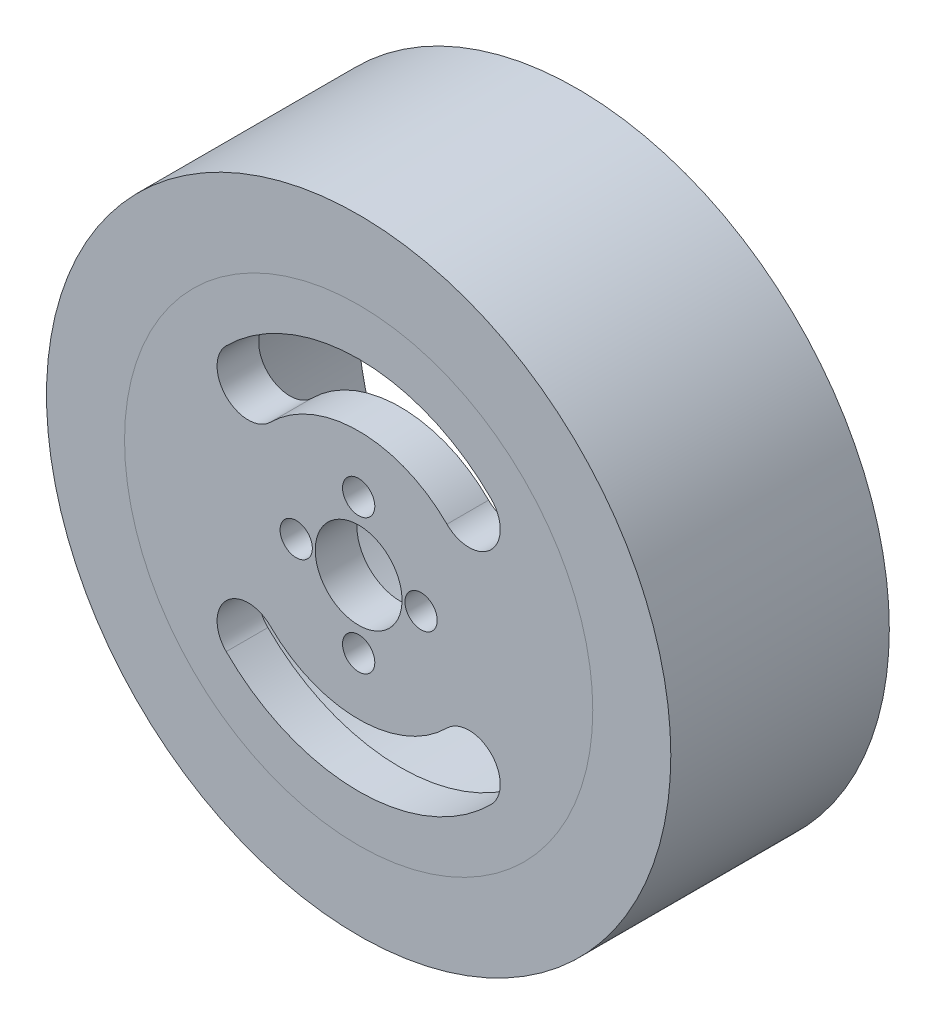
from build123d import *

# Parameters (mm, degrees)
SKETCH_1_R          = 22.5
EXTRUDE_1_DEPTH     = 21
SKETCH_2_R          = 21
CUT_EXTRUDE_1_DEPTH = 17
SKETCH_3_R          = 3
SKETCH_3_R_2        = 4.17
SKETCH_3_R_3        = 1.55
CUT_EXTRUDE_2_DEPTH = 37.076308015
SKETCH_5_R          = 30
SKETCH_5_R_2        = 22.5
EXTRUDE_2_DEPTH     = 21


with BuildPart() as part:
    # ｽｹｯﾁ1 → ﾎﾞｽ - 押し出し1 (new body)
    with BuildSketch(Plane.XY):
        with Locations(Location((0, 0, 0), (0, 0, 180))):
            Circle(SKETCH_1_R)
    extrude(amount=EXTRUDE_1_DEPTH)

    # ｽｹｯﾁ2 → ｶｯﾄ - 押し出し1 (cut)
    with BuildSketch(Plane(origin=(0, 0, 0), x_dir=(-1, 0, 0), z_dir=(0, 0, -1))):
        Circle(SKETCH_2_R)
    extrude(amount=-CUT_EXTRUDE_1_DEPTH, mode=Mode.SUBTRACT)

    # ｽｹｯﾁ3 → ｶｯﾄ - 押し出し2 (cut, through all)
    with BuildSketch(Plane(origin=(0, 0, 17), x_dir=(-1, 0, 0), z_dir=(0, 0, -1))):
        with BuildLine():
            ThreePointArc((-12.727922061, 12.727922061), (-9.458551421, 13.378240315), (-7.606601718, 10.606601718))
            ThreePointArc((-7.606601718, 10.606601718), (-7.83496312, 9.458551421), (-8.485281374, 8.485281374))
            ThreePointArc((-8.485281374, 8.485281374), (0, 12), (8.485281374, 8.485281374))
            ThreePointArc((8.485281374, 8.485281374), (8.485281374, 12.727922061), (12.727922061, 12.727922061))
            ThreePointArc((12.727922061, 12.727922061), (0, 18), (-12.727922061, 12.727922061))
        make_face()
        with Locations((-10.606601718, 10.606601718)):
            Circle(SKETCH_3_R)
        with Locations((10.606601718, 10.606601718)):
            Circle(SKETCH_3_R)
        Circle(SKETCH_3_R_2)
        with Locations((6, 0)):
            Circle(SKETCH_3_R_3)
        with Locations((0, 6.5)):
            Circle(SKETCH_3_R_3)
        with Locations((-6, 0)):
            Circle(SKETCH_3_R_3)
        with Locations((0, -6.5)):
            Circle(SKETCH_3_R_3)
        with Locations((-10.606601718, -10.606601718)):
            Circle(SKETCH_3_R)
        with BuildLine():
            ThreePointArc((12.727922061, -12.727922061), (8.485281374, -12.727922061), (8.485281374, -8.485281374))
            ThreePointArc((8.485281374, -8.485281374), (0, -12), (-8.485281374, -8.485281374))
            ThreePointArc((-8.485281374, -8.485281374), (-7.83496312, -9.458551421), (-7.606601718, -10.606601718))
            ThreePointArc((-7.606601718, -10.606601718), (-9.458551421, -13.378240315), (-12.727922061, -12.727922061))
            ThreePointArc((-12.727922061, -12.727922061), (0, -18), (12.727922061, -12.727922061))
        make_face()
        with Locations((10.606601718, -10.606601718)):
            Circle(SKETCH_3_R)
    extrude(amount=-CUT_EXTRUDE_2_DEPTH, mode=Mode.SUBTRACT)


with BuildPart() as body_2:
    # ｽｹｯﾁ5 → ﾎﾞｽ - 押し出し2 (new body)
    with BuildSketch(Plane.XY.offset(21)):
        Circle(SKETCH_5_R)
        Circle(SKETCH_5_R_2, mode=Mode.SUBTRACT)
    extrude(amount=-EXTRUDE_2_DEPTH)


solid = Compound([part.part, body_2.part])
